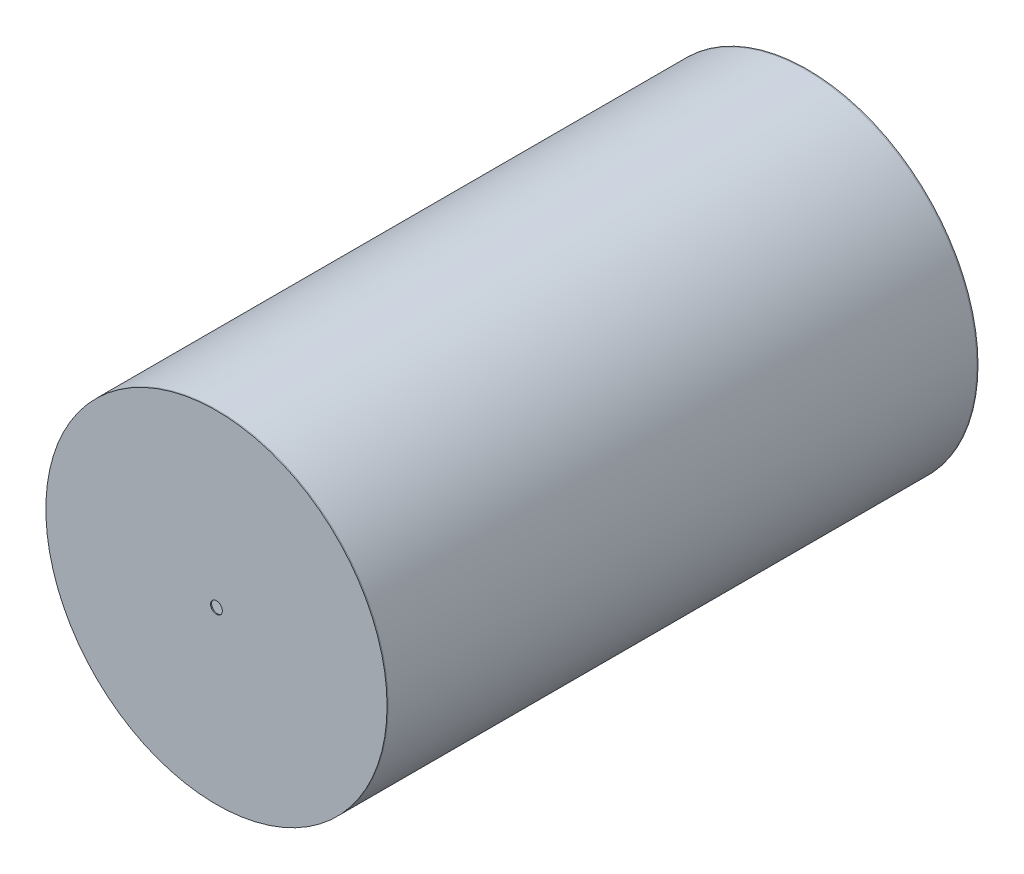
from build123d import *

# Parameters (mm, degrees)
SKETCH1_R           = 332
BOSS_EXTRUDE1_DEPTH = 2
SKETCH2_R           = 332
SKETCH2_R_2         = 330
BOSS_EXTRUDE2_DEPTH = 1145.92
SKETCH4_R           = 332
BOSS_EXTRUDE4_DEPTH = 2
SKETCH5_R           = 11.45
CUT_EXTRUDE1_DEPTH  = 2


with BuildPart() as part:
    # Sketch1 → Boss-Extrude1 (new body)
    with BuildSketch(Plane.XY):
        Circle(SKETCH1_R)
    extrude(amount=BOSS_EXTRUDE1_DEPTH)


with BuildPart() as body_2:
    # Sketch2 → Boss-Extrude2 (new body)
    with BuildSketch(Plane.XY.offset(2)):
        Circle(SKETCH2_R)
        Circle(SKETCH2_R_2, mode=Mode.SUBTRACT)
    extrude(amount=BOSS_EXTRUDE2_DEPTH)


with BuildPart() as body_3:
    # Sketch4 → Boss-Extrude4 (new body)
    with BuildSketch(Plane.XY.offset(1147.92)):
        Circle(SKETCH4_R)
    extrude(amount=BOSS_EXTRUDE4_DEPTH)

    # Sketch5 → Cut-Extrude1 (cut)
    with BuildSketch(Plane.XY.offset(1149.92)):
        Circle(SKETCH5_R)
    extrude(amount=-CUT_EXTRUDE1_DEPTH, mode=Mode.SUBTRACT)


solid = Compound([part.part, body_2.part, body_3.part])
